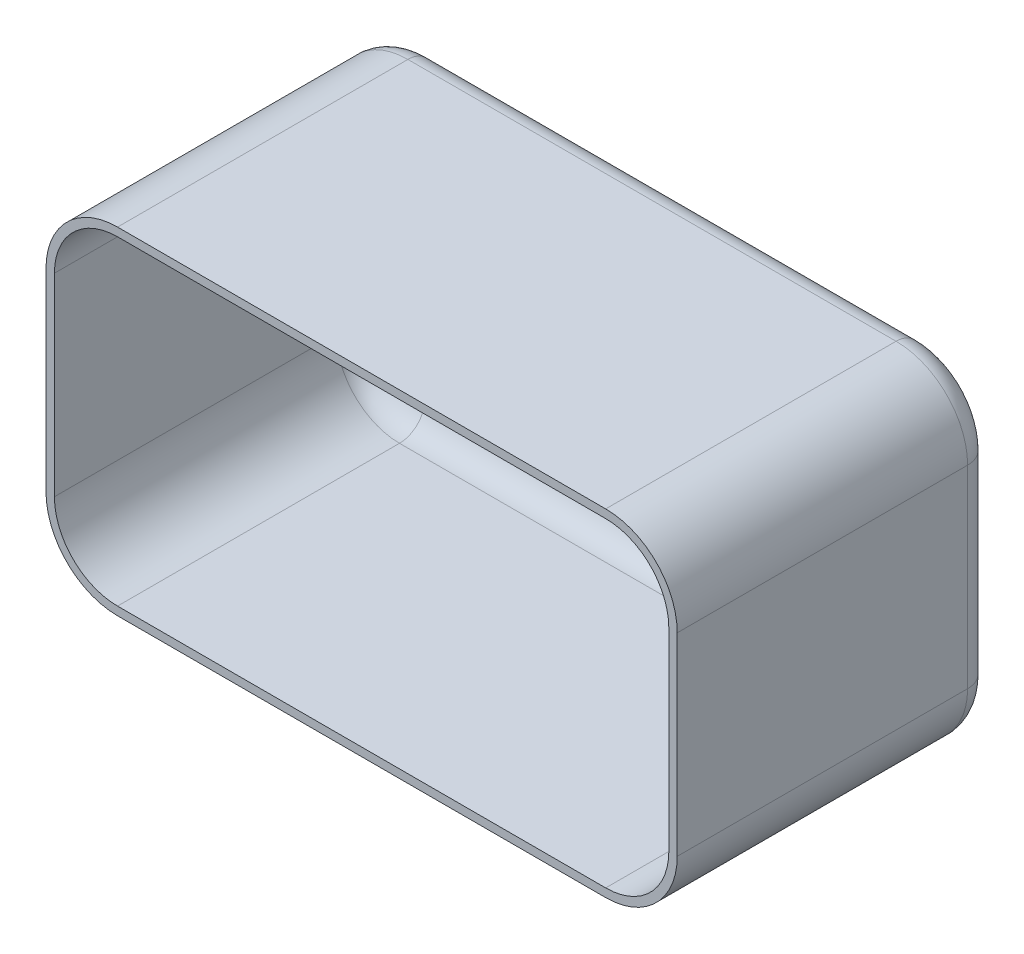
from build123d import *

# Parameters (mm, degrees)
BOSS_EXTRUDE1_DEPTH = 75
BOSS_EXTRUDE2_DEPTH = 2
FILLET1_R           = 6


with BuildPart() as part:
    # Sketch2 → Boss-Extrude1 (new body)
    with BuildSketch(Plane.XY):
        with BuildLine():
            Line((-167.97646099, 146.257283518), (-51.97646099, 146.257283518))
            ThreePointArc((-51.97646099, 146.257283518), (-39.95564571, 141.278098799), (-34.97646099, 129.257283518))
            Line((-34.97646099, 129.257283518), (-34.97646099, 83.257283518))
            ThreePointArc((-34.97646099, 83.257283518), (-39.95564571, 71.236468238), (-51.97646099, 66.257283518))
            Line((-51.97646099, 66.257283518), (-167.97646099, 66.257283518))
            ThreePointArc((-167.97646099, 66.257283518), (-179.99727627, 71.236468238), (-184.97646099, 83.257283518))
            Line((-184.97646099, 83.257283518), (-184.97646099, 129.257283518))
            ThreePointArc((-184.97646099, 129.257283518), (-179.99727627, 141.278098799), (-167.97646099, 146.257283518))
        make_face()
        with BuildLine():
            Line((-167.97646099, 144.257283518), (-51.97646099, 144.257283518))
            ThreePointArc((-51.97646099, 144.257283518), (-41.369859272, 139.863885236), (-36.97646099, 129.257283518))
            Line((-36.97646099, 129.257283518), (-36.97646099, 83.257283518))
            ThreePointArc((-36.97646099, 83.257283518), (-41.369859272, 72.650681801), (-51.97646099, 68.257283518))
            Line((-51.97646099, 68.257283518), (-167.97646099, 68.257283518))
            ThreePointArc((-167.97646099, 68.257283518), (-178.583062708, 72.650681801), (-182.97646099, 83.257283518))
            Line((-182.97646099, 83.257283518), (-182.97646099, 129.257283518))
            ThreePointArc((-182.97646099, 129.257283518), (-178.583062708, 139.863885236), (-167.97646099, 144.257283518))
        make_face(mode=Mode.SUBTRACT)
    extrude(amount=BOSS_EXTRUDE1_DEPTH)

    # Sketch3 → Boss-Extrude2 (add)
    with BuildSketch(Plane(origin=(0, 0, 0), x_dir=(-1, 0, 0), z_dir=(0, 0, -1))):
        with BuildLine():
            Line((34.97646099, 129.257283518), (34.97646099, 83.257283518))
            ThreePointArc((34.97646099, 83.257283518), (39.95564571, 71.236468238), (51.97646099, 66.257283518))
            Line((51.97646099, 66.257283518), (167.97646099, 66.257283518))
            ThreePointArc((167.97646099, 66.257283518), (179.99727627, 71.236468238), (184.97646099, 83.257283518))
            Line((184.97646099, 83.257283518), (184.97646099, 129.257283518))
            ThreePointArc((184.97646099, 129.257283518), (179.99727627, 141.278098799), (167.97646099, 146.257283518))
            Line((167.97646099, 146.257283518), (51.97646099, 146.257283518))
            ThreePointArc((51.97646099, 146.257283518), (39.95564571, 141.278098799), (34.97646099, 129.257283518))
        make_face()
    extrude(amount=-BOSS_EXTRUDE2_DEPTH)

    # Fillet1
    fillet1_edges = [part.edges().sort_by_distance(p)[0] for p in [
        (-184.97646099, 106.257283518, 0),
        (-179.99727627, 141.278098799, 0),
        (-109.97646099, 146.257283518, 0),
        (-39.95564571, 141.278098799, 0),
        (-109.97646099, 144.257283518, 2),
        (-182.97646099, 106.257283518, 2),
        (-178.583062708, 139.863885236, 2),
        (-41.369859272, 139.863885236, 2),
        (-36.97646099, 106.257283518, 2),
        (-41.369859272, 72.650681801, 2),
        (-109.97646099, 68.257283518, 2),
        (-178.583062708, 72.650681801, 2),
        (-34.97646099, 106.257283518, 0),
        (-39.95564571, 71.236468238, 0),
        (-109.97646099, 66.257283518, 0),
        (-179.99727627, 71.236468238, 0),
    ]]
    fillet(fillet1_edges, radius=FILLET1_R)


solid = part.part
